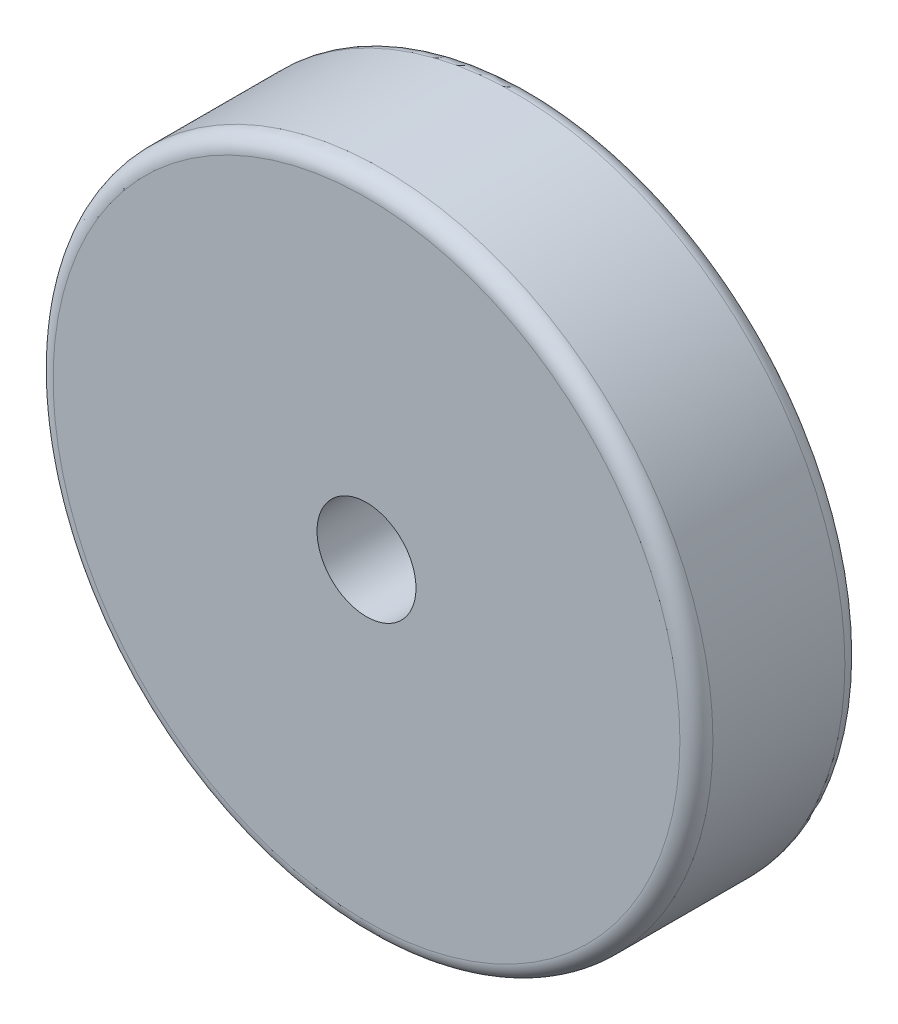
from build123d import *

# Parameters (mm, degrees)
SKETCH_1_R      = 20
SKETCH_1_R_2    = 3
EXTRUDE_1_DEPTH = 10
FILLET_1_R      = 1


with BuildPart() as part:
    # 草图1 → 凸台-拉伸1 (new body)
    with BuildSketch(Plane.XY):
        Circle(SKETCH_1_R)
        Circle(SKETCH_1_R_2, mode=Mode.SUBTRACT)
    extrude(amount=EXTRUDE_1_DEPTH)

    # 圆角1
    fillet_1_edges = [part.edges().sort_by_distance(p)[0] for p in [
        (-20, 0, 0),
        (-20, 0, 10),
    ]]
    fillet(fillet_1_edges, radius=FILLET_1_R)


solid = part.part
